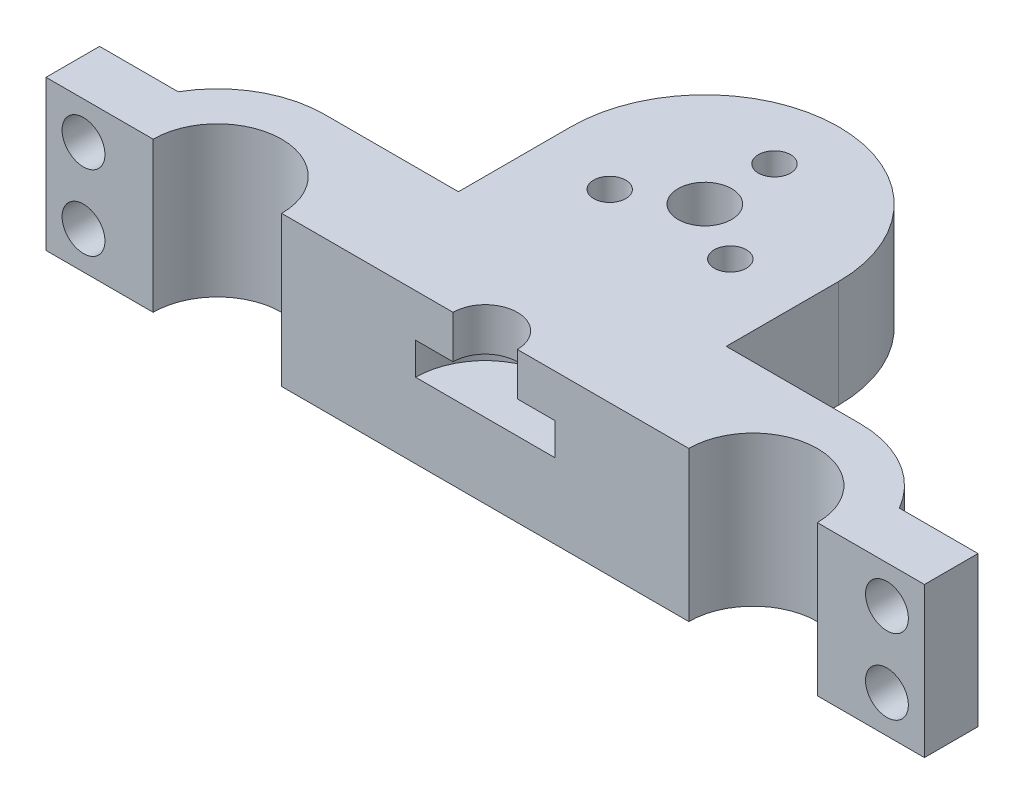
from build123d import *

# Parameters (mm, degrees)
BOSS_EXTRUDE1_DEPTH     = 14
CUT_EXTRUDE1_DEPTH      = 45.463468151
CUT_EXTRUDE1_DEPTH_BACK = 45.463468151
SKETCH4_R               = 2
SKETCH5_W               = 9.30871577
SKETCH5_H               = 4.044371358
BOSS_EXTRUDE2_DEPTH     = 7
CUT_EXTRUDE2_START      = 1.5
SKETCH6_R               = 6.5
CUT_EXTRUDE2_DEPTH      = 1.5
BOSS_EXTRUDE3_DEPTH     = 10
SKETCH8_R               = 10
CUT_EXTRUDE3_DEPTH      = 4
SKETCH9_R               = 2.5
CUT_EXTRUDE4_DEPTH      = 54.235326617
SKETCH10_R              = 1.5
CUT_EXTRUDE5_DEPTH      = 54.235326617


with BuildPart() as part:
    # Sketch2 → Boss-Extrude1 (new body)
    with BuildSketch(Plane(origin=(0, 0, 0), x_dir=(1, 0, 0), z_dir=(0, 1, 0))):
        with BuildLine():
            Line((-3, 0), (-19, 0))
            ThreePointArc((-19, 0), (-25, 6), (-31, 0))
            Line((-31, 0), (-41, 0))
            Line((-41, 0), (-41, 5))
            Line((-41, 5), (-33.660254038, 5))
            ThreePointArc((-33.660254038, 5), (-30, 8.660254038), (-25, 10))
            Line((-25, 10), (25, 10))
            ThreePointArc((25, 10), (30, 8.660254038), (33.660254038, 5))
            Line((33.660254038, 5), (41, 5))
            Line((41, 5), (41, 0))
            Line((41, 0), (31, 0))
            ThreePointArc((31, 0), (25, 6), (19, 0))
            Line((19, 0), (3, 0))
            ThreePointArc((3, 0), (0, 3), (-3, 0))
        make_face()
    extrude(amount=BOSS_EXTRUDE1_DEPTH)

    # Sketch4 → Cut-Extrude1 (cut, two sides: drawn at the far end of the back side and taken through both)
    with BuildSketch(Plane.XY.offset(-CUT_EXTRUDE1_DEPTH_BACK)):
        with Locations((-37.5, 10.5)):
            Circle(SKETCH4_R)
        with Locations((-37.5, 3.5)):
            Circle(SKETCH4_R)
        with Locations((37.5, 10.5)):
            Circle(SKETCH4_R)
        with Locations((37.5, 3.5)):
            Circle(SKETCH4_R)
    extrude(amount=CUT_EXTRUDE1_DEPTH + CUT_EXTRUDE1_DEPTH_BACK, mode=Mode.SUBTRACT)

    # Sketch5 → Boss-Extrude2 (add)
    with BuildSketch(Plane.XZ):
        with Locations((-0.028958253, -2.022185679)):
            Rectangle(SKETCH5_W, SKETCH5_H)
    extrude(amount=-BOSS_EXTRUDE2_DEPTH)

    # Sketch6 → Cut-Extrude2 (cut, symmetric)
    with BuildSketch(Plane(origin=(0, 7, 0), x_dir=(1, 0, 0), z_dir=(0, 1, 0)).offset(CUT_EXTRUDE2_START)):
        Circle(SKETCH6_R)
    extrude(amount=CUT_EXTRUDE2_DEPTH, both=True, mode=Mode.SUBTRACT)

    # Sketch7 → Boss-Extrude3 (add)
    with BuildSketch(Plane(origin=(0, 14, 0), x_dir=(1, 0, 0), z_dir=(0, 1, 0))):
        with BuildLine():
            Line((-12.5, 20.5), (-12.5, 10))
            Line((-12.5, 10), (12.5, 10))
            Line((12.5, 10), (12.5, 20.5))
            ThreePointArc((12.5, 20.5), (0, 33), (-12.5, 20.5))
        make_face()
    extrude(amount=-BOSS_EXTRUDE3_DEPTH)

    # Sketch8 → Cut-Extrude3 (cut)
    with BuildSketch(Plane.XZ.offset(-4)):
        with Locations(Location((0, -20.5, 0), (0, 0, 270))):
            Circle(SKETCH8_R)
    extrude(amount=-CUT_EXTRUDE3_DEPTH, mode=Mode.SUBTRACT)

    # Sketch9 → Cut-Extrude4 (cut, through all)
    with BuildSketch(Plane.XZ.offset(-8)):
        with Locations(Location((0, -20.5, 0), (0, 0, 270))):
            Circle(SKETCH9_R)
    extrude(amount=-CUT_EXTRUDE4_DEPTH, mode=Mode.SUBTRACT)

    # Sketch10 → Cut-Extrude5 (cut, through all)
    with BuildSketch(Plane.XZ.offset(-8)):
        with Locations(Location((0, -27, 0), (0, 0, 270))):
            Circle(SKETCH10_R)
        with Locations(Location((-5.629165125, -17.25, 0), (0, 0, 270))):
            Circle(SKETCH10_R)
        with Locations(Location((5.629165125, -17.25, 0), (0, 0, 270))):
            Circle(SKETCH10_R)
    extrude(amount=-CUT_EXTRUDE5_DEPTH, mode=Mode.SUBTRACT)


solid = part.part
